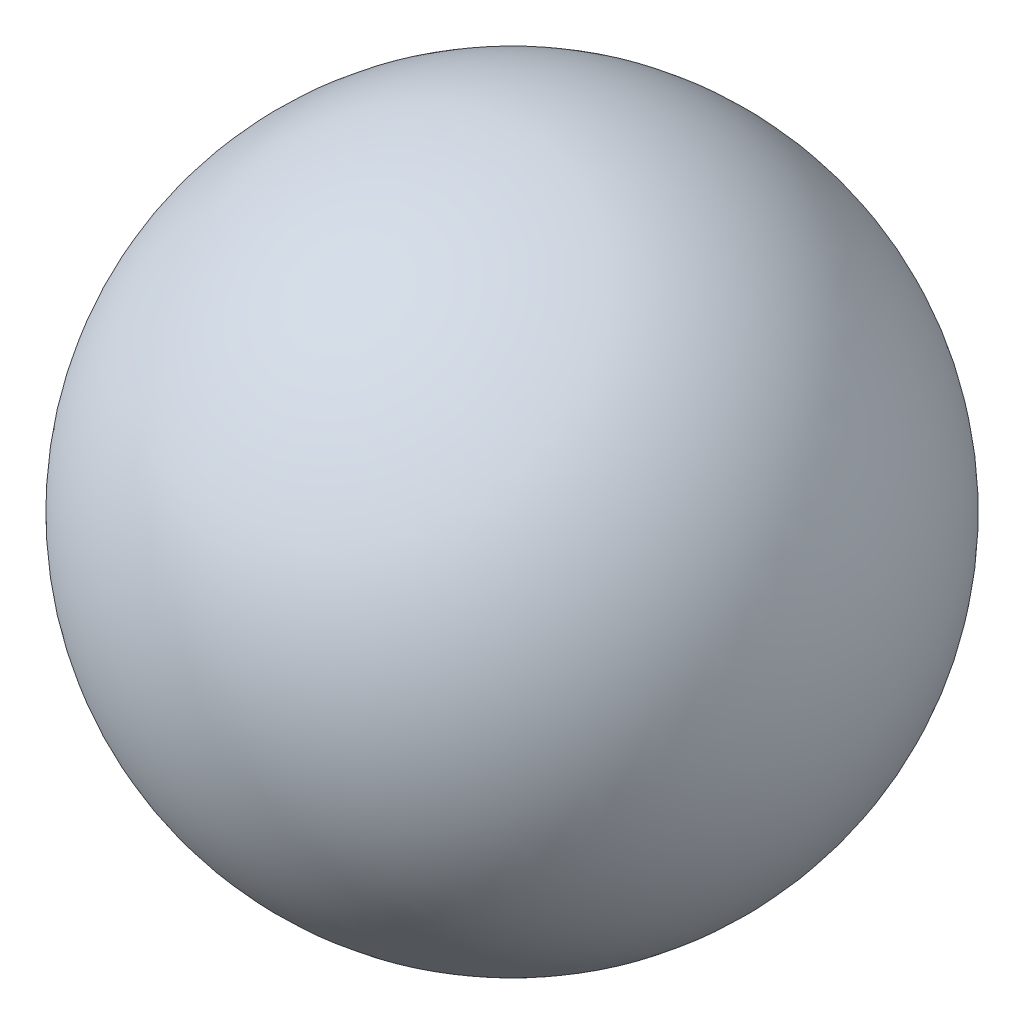
from build123d import *


with BuildPart() as part:
    # Croquis1 → Revolución2 (revolve)
    with BuildSketch(Plane.XY):
        with BuildLine():
            Line((0, -21.5), (0, 21.5))
            ThreePointArc((0, 21.5), (21.5, 0), (0, -21.5))
        make_face()
    revolve(axis=Axis((0, 25.813393979, 0), (0, -1, 0)))


solid = part.part
